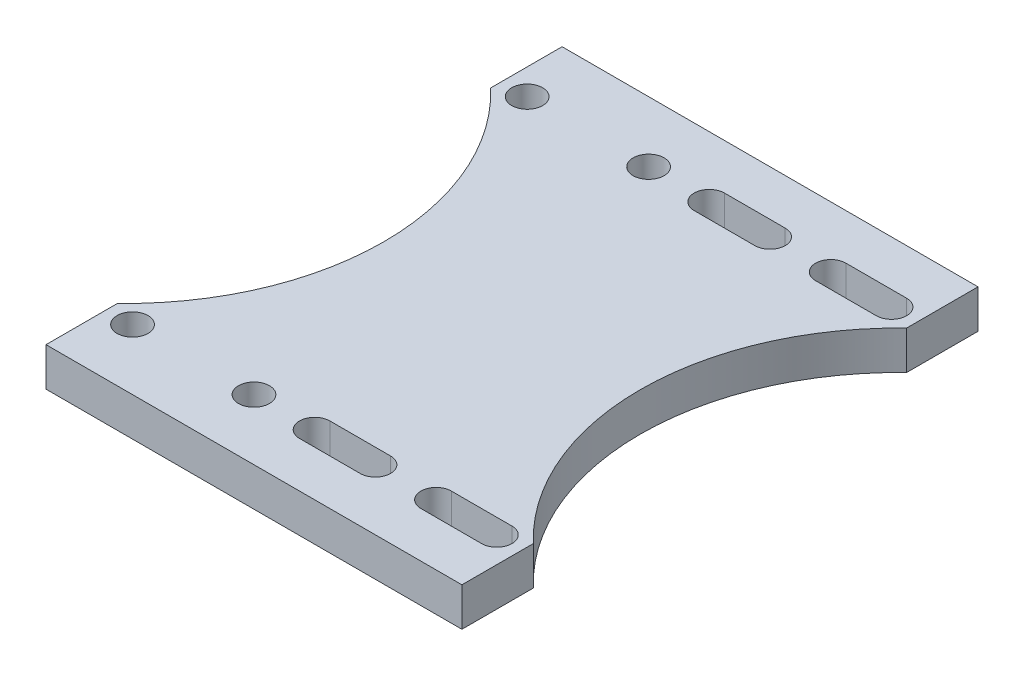
from build123d import *

# Parameters (mm, degrees)
SKETCH1_R           = 2.55
BOSS_EXTRUDE1_DEPTH = 6.35


with BuildPart() as part:
    # Sketch1 → Boss-Extrude1 (new body)
    with BuildSketch(Plane(origin=(0, 0, 0), x_dir=(1, 0, 0), z_dir=(0, 1, 0))):
        with BuildLine():
            Line((0, -42.5), (-35, -42.5))
            Line((-35, -42.5), (-35, -30.733037331))
            ThreePointArc((-35, -30.733037331), (-21.855245126, 0), (-35, 30.733037331))
            Line((-35, 30.733037331), (-35, 42.5))
            Line((-35, 42.5), (0, 42.5))
            Line((0, 42.5), (33.5, 42.5))
            Line((33.5, 42.5), (33.5, 32.5))
            Line((33.5, 32.5), (33.5, 30.733037331))
            ThreePointArc((33.5, 30.733037331), (20.355245126, 0), (33.5, -30.733037331))
            Line((33.5, -30.733037331), (33.5, -32.5))
            Line((33.5, -32.5), (33.5, -42.5))
            Line((33.5, -42.5), (0, -42.5))
        make_face()
        with Locations(Location((-30.75, -32.5, 0), (0, 0, 270))):
            Circle(SKETCH1_R, mode=Mode.SUBTRACT)
        with Locations(Location((-30.75, 32.5, 0), (0, 0, 270))):
            Circle(SKETCH1_R, mode=Mode.SUBTRACT)
        with Locations(Location((-10.75, 32.5, 0), (0, 0, 270))):
            Circle(SKETCH1_R, mode=Mode.SUBTRACT)
        with Locations(Location((-10.75, -32.5, 0), (0, 0, 270))):
            Circle(SKETCH1_R, mode=Mode.SUBTRACT)
        with BuildLine():
            Line((29.25, -35), (19.25, -35))
            ThreePointArc((19.25, -35), (16.75, -32.5), (19.25, -30))
            Line((19.25, -30), (29.25, -30))
            ThreePointArc((29.25, -30), (31.75, -32.5), (29.25, -35))
        make_face(mode=Mode.SUBTRACT)
        with BuildLine():
            Line((9.25, -35), (-0.75, -35))
            ThreePointArc((-0.75, -35), (-3.25, -32.5), (-0.75, -30))
            Line((-0.75, -30), (9.25, -30))
            ThreePointArc((9.25, -30), (11.75, -32.5), (9.25, -35))
        make_face(mode=Mode.SUBTRACT)
        with BuildLine():
            Line((29.25, 30), (19.25, 30))
            ThreePointArc((19.25, 30), (16.75, 32.5), (19.25, 35))
            Line((19.25, 35), (29.25, 35))
            ThreePointArc((29.25, 35), (31.75, 32.5), (29.25, 30))
        make_face(mode=Mode.SUBTRACT)
        with BuildLine():
            Line((9.25, 30), (-0.75, 30))
            ThreePointArc((-0.75, 30), (-3.25, 32.5), (-0.75, 35))
            Line((-0.75, 35), (9.25, 35))
            ThreePointArc((9.25, 35), (11.75, 32.5), (9.25, 30))
        make_face(mode=Mode.SUBTRACT)
    extrude(amount=-BOSS_EXTRUDE1_DEPTH)


solid = part.part
